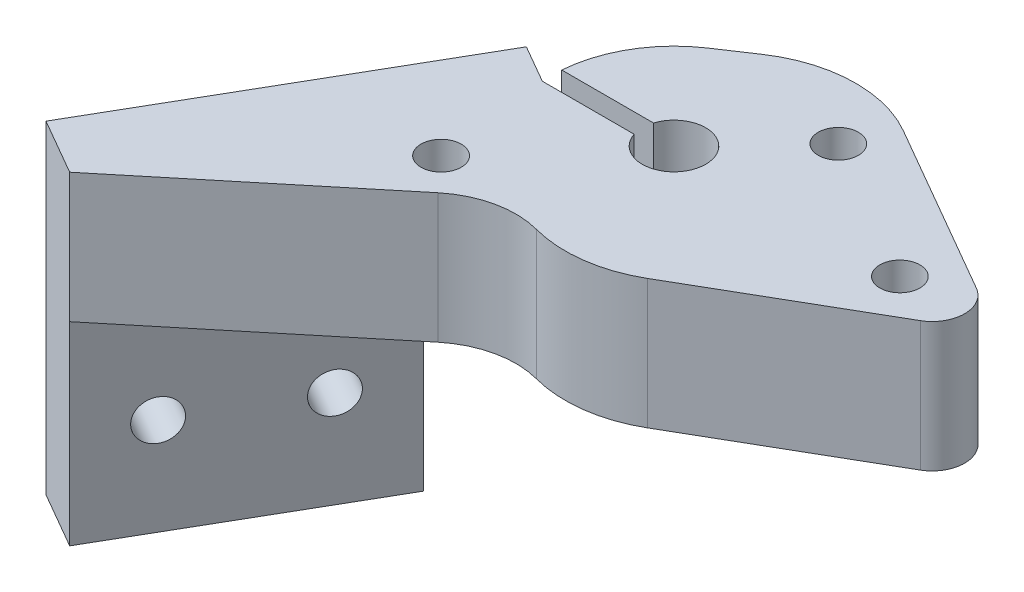
from build123d import *

# Parameters (mm, degrees)
SKETCH1_R                       = 1.55
SKETCH1_R_2                     = 2.45
BOSS_EXTRUDE1_DEPTH             = 10
SKETCH2_W                       = 9.45
SKETCH2_H                       = 1.5
CUT_EXTRUDE1_DEPTH              = 25.542893997
BOSS_EXTRUDE3_DEPTH             = 10
BOSS_EXTRUDE4_DEPTH             = 15
F_3_0MM_CLEARANCE_DOWEL_HOLE2_D = 3.108
F_3_0MM_CLEARANCE_DOWEL_HOLE3_D = 3.108
FILLET2_R                       = 7


with BuildPart() as part:
    # Sketch1 → Boss-Extrude1 (new body)
    with BuildSketch(Plane(origin=(0, 0, 0), x_dir=(1, 0, 0), z_dir=(0, 1, 0))):
        with BuildLine():
            Line((11.25, 2.165063509), (-2.121223771, 9.884943153))
            ThreePointArc((-2.121223771, 9.884943153), (-7.442989886, 11.219511103), (-12.667897108, 9.545411133))
            Line((-12.667897108, 9.545411133), (-15.191606303, 7.863082307))
            ThreePointArc((-15.191606303, 7.863082307), (-19.4, 0), (-15.191606303, -7.863082307))
            Line((-15.191606303, -7.863082307), (-12.667897108, -9.545411133))
            ThreePointArc((-12.667897108, -9.545411133), (-7.442989886, -11.219511103), (-2.121223771, -9.884943153))
            Line((-2.121223771, -9.884943153), (11.25, -2.165063509))
            ThreePointArc((11.25, -2.165063509), (12.5, 0), (11.25, 2.165063509))
        make_face()
        with Locations(Location((7.5, 0, 0), (0, 0, 270))):
            Circle(SKETCH1_R, mode=Mode.SUBTRACT)
        with Locations(Location((-3.75, 6.495190528, 0), (0, 0, 270))):
            Circle(SKETCH1_R, mode=Mode.SUBTRACT)
        with Locations(Location((-9.95, 0, 0), (0, 0, 270))):
            Circle(SKETCH1_R_2, mode=Mode.SUBTRACT)
    extrude(amount=BOSS_EXTRUDE1_DEPTH)

    # Sketch2 → Cut-Extrude1 (cut, through all)
    with BuildSketch(Plane(origin=(0, 10, 0), x_dir=(1, 0, 0), z_dir=(0, 1, 0))):
        with Locations((-14.675, 0)):
            Rectangle(SKETCH2_W, SKETCH2_H)
    extrude(amount=-CUT_EXTRUDE1_DEPTH, mode=Mode.SUBTRACT)

    # Sketch3 → Boss-Extrude3 (add)
    with BuildSketch(Plane.XZ):
        with BuildLine():
            Line((-35.868683143, 22.59247598), (-22.285990587, -0.93343763))
            Line((-22.285990587, -0.93343763), (-19.370191081, 0.75))
            ThreePointArc((-19.370191081, 0.75), (-18.098070975, 4.786589536), (-15.191606303, 7.863082307))
            Line((-15.191606303, 7.863082307), (-12.667897108, 9.545411133))
            Line((-12.667897108, 9.545411133), (-31.538556124, 25.09247598))
            Line((-31.538556124, 25.09247598), (-35.868683143, 22.59247598))
        make_face()
    extrude(amount=-BOSS_EXTRUDE3_DEPTH)

    # Sketch4 → Boss-Extrude4 (add)
    with BuildSketch(Plane(origin=(0, 0, 0), x_dir=(1, 0, 0), z_dir=(0, 1, 0))):
        Polygon((-35.868683143, -22.59247598), (-25.868683143, -5.271967904), (-21.538556124, -7.771967904), (-31.538556124, -25.09247598), align=None)
    extrude(amount=-BOSS_EXTRUDE4_DEPTH)

    # Ø3.0mm Clearance Dowel Hole2 (through all)
    with Locations(Plane(origin=(-12.788556272, 0, -7.383476406), x_dir=(0.5000000000000013, 0, -0.8660254037844379), z_dir=(0.8660254037844379, 0, 0.5000000000000013))):
        with Locations((-22.499999704, -7.5), (-32.499999704, -7.5)):
            Hole(F_3_0MM_CLEARANCE_DOWEL_HOLE2_D / 2)

    # Ø3.0mm Clearance Dowel Hole3 (through all)
    with Locations(Plane(origin=(0, 0, 0), x_dir=(-1, 0, 0), z_dir=(0, -1, 0))):
        with Locations((18.297907491, -9.642957265)):
            Hole(F_3_0MM_CLEARANCE_DOWEL_HOLE3_D / 2)

    # Fillet2
    fillet2_edges = [part.edges().sort_by_distance(p)[0] for p in [
        (-12.667897108, 5, 9.545411133),
    ]]
    fillet(fillet2_edges, radius=FILLET2_R)


solid = part.part
